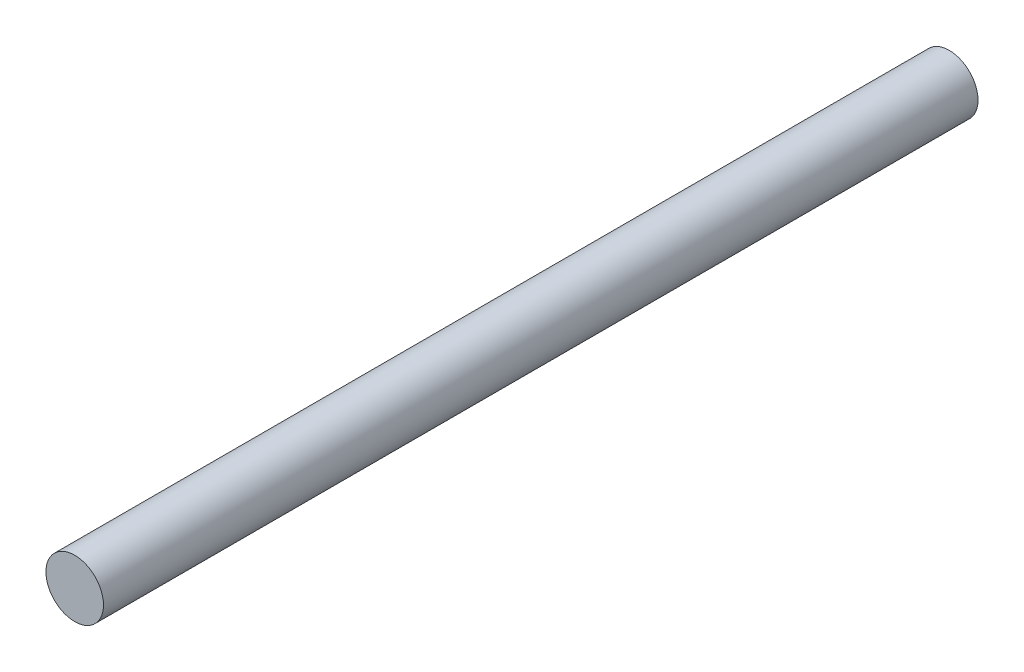
from build123d import *

# Parameters (mm, degrees)
SKETCH1_R           = 2.5
BOSS_EXTRUDE1_DEPTH = 76


with BuildPart() as part:
    # Sketch1 → Boss-Extrude1 (new body)
    with BuildSketch(Plane.XY):
        Circle(SKETCH1_R)
    extrude(amount=BOSS_EXTRUDE1_DEPTH)


solid = part.part
